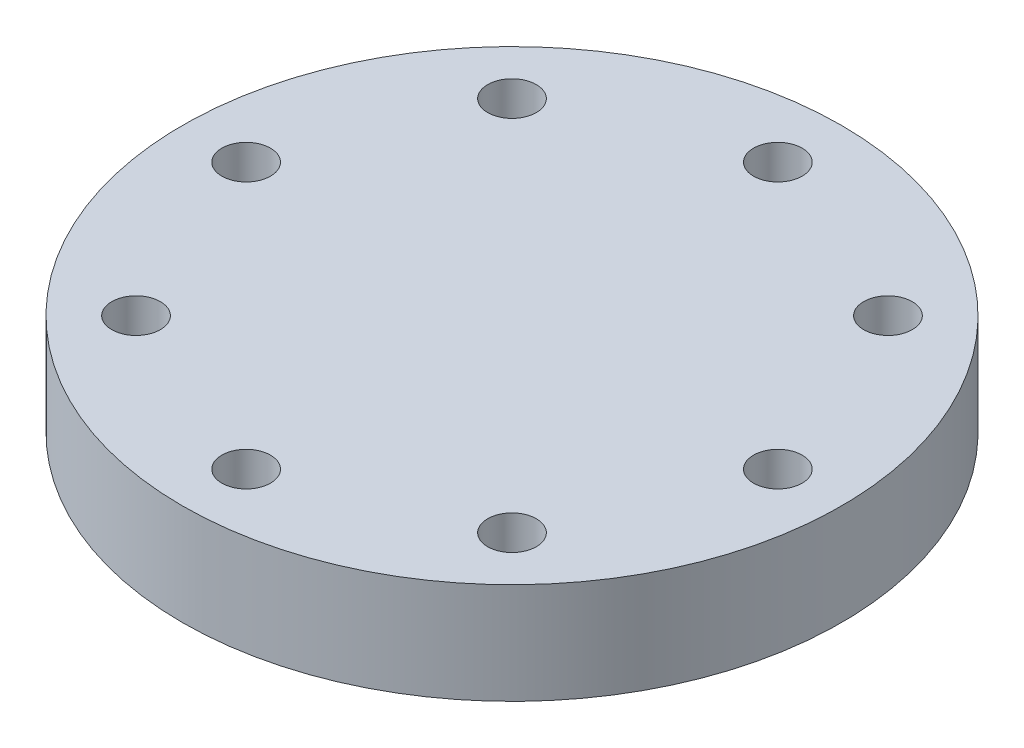
from build123d import *

# Parameters (mm, degrees)
SKETCH1_R          = 57.15
EXTRUDE1_DEPTH     = 17.526
SKETCH2_R          = 4.2164
CUT_EXTRUDE2_DEPTH = 17.526
CIRPATTERN1_COUNT  = 8


with BuildPart() as part:
    # Sketch1 → Extrude1 (new body)
    with BuildSketch(Plane(origin=(0, 0, 0), x_dir=(1, 0, 0), z_dir=(0, 1, 0))):
        Circle(SKETCH1_R)
    extrude(amount=EXTRUDE1_DEPTH)

    # Sketch2 → Cut-Extrude2 (cut)
    with BuildSketch(Plane(origin=(0, 0, 0), x_dir=(1, 0, 0), z_dir=(0, 1, 0))):
        with Locations((0, 46.101)):
            Circle(SKETCH2_R)
    cut_extrude2 = extrude(amount=CUT_EXTRUDE2_DEPTH, mode=Mode.SUBTRACT)

    # CirPattern1: Cut-Extrude2 ×8 about axis
    cirpattern1_axis = Axis((0, 58.676993495, 0), (0, -1, 0))
    for i in range(1, CIRPATTERN1_COUNT):
        add(cut_extrude2.rotate(cirpattern1_axis, i * 360 / CIRPATTERN1_COUNT), mode=Mode.SUBTRACT)


solid = part.part
